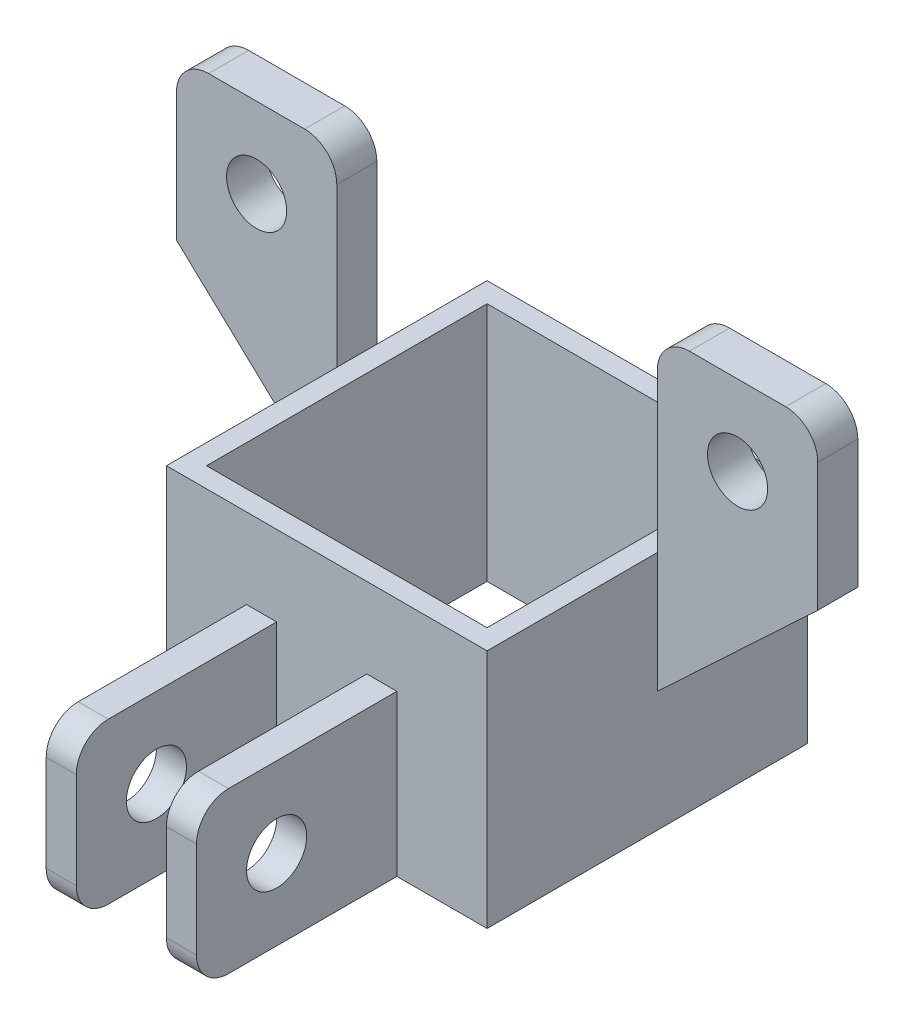
from build123d import *

# Parameters (mm, degrees)
SKETCH2_W           = 50.8
SKETCH2_H           = 38.1
BOSS_EXTRUDE1_DEPTH = 50.8
SKETCH5_W           = 44.45
SKETCH5_H           = 44.45
CUT_EXTRUDE3_DEPTH  = 82.319677815
SKETCH7_W           = 4.7625
SKETCH7_H           = 25.4
BOSS_EXTRUDE2_DEPTH = 31.75
FILLET1_R           = 5.08
SKETCH8_R           = 4.7625
CUT_EXTRUDE4_DEPTH  = 74.248977169
BOSS_EXTRUDE3_DEPTH = 6.35
SKETCH10_R          = 4.7625
CUT_EXTRUDE5_DEPTH  = 118.96738029
FILLET2_R           = 5.08


with BuildPart() as part:
    # Sketch2 → Boss-Extrude1 (new body)
    with BuildSketch(Plane.XY):
        with Locations((25.4, 19.05)):
            Rectangle(SKETCH2_W, SKETCH2_H)
    extrude(amount=-BOSS_EXTRUDE1_DEPTH)

    # Sketch5 → Cut-Extrude3 (cut, through all)
    with BuildSketch(Plane(origin=(0, 38.1, 0), x_dir=(1, 0, 0), z_dir=(0, 1, 0))):
        with Locations((25.4, 25.4)):
            Rectangle(SKETCH5_W, SKETCH5_H)
    extrude(amount=-CUT_EXTRUDE3_DEPTH, mode=Mode.SUBTRACT)

    # Sketch7 → Boss-Extrude2 (add)
    with BuildSketch(Plane.XY):
        with Locations((15.08125, 12.7)):
            Rectangle(SKETCH7_W, SKETCH7_H)
        with Locations((34.13125, 12.7)):
            Rectangle(SKETCH7_W, SKETCH7_H)
    extrude(amount=BOSS_EXTRUDE2_DEPTH)

    # Fillet1
    fillet1_edges = [part.edges().sort_by_distance(p)[0] for p in [
        (15.08125, 0, 31.75),
        (15.08125, 25.4, 31.75),
        (34.13125, 0, 31.75),
        (34.13125, 25.4, 31.75),
    ]]
    fillet(fillet1_edges, radius=FILLET1_R)

    # Sketch8 → Cut-Extrude4 (cut, through all)
    with BuildSketch(Plane(origin=(36.5125, 0, 0), x_dir=(0, 0, -1), z_dir=(1, 0, 0))):
        with Locations((-19.05, 12.7)):
            Circle(SKETCH8_R)
    extrude(amount=-CUT_EXTRUDE4_DEPTH, mode=Mode.SUBTRACT)

    # Sketch9 → Boss-Extrude3 (add)
    with BuildSketch(Plane(origin=(0, 0, -33.3375), x_dir=(-1, 0, 0), z_dir=(0, 0, -1))):
        Polygon((0, 38.1), (0, 68.2625), (25.4, 68.2625), (25.4, 42.8625), (0, 19.05), align=None)
        Polygon((-76.2, 42.8625), (-50.8, 19.05), (-50.8, 38.1), (-50.8, 68.2625), (-76.2, 68.2625), align=None)
    extrude(amount=-BOSS_EXTRUDE3_DEPTH)

    # Sketch10 → Cut-Extrude5 (cut, through all)
    with BuildSketch(Plane.XY.offset(-26.9875)):
        with Locations((-12.7, 55.5625)):
            Circle(SKETCH10_R)
        with Locations((63.5, 55.5625)):
            Circle(SKETCH10_R)
    extrude(amount=-CUT_EXTRUDE5_DEPTH, mode=Mode.SUBTRACT)

    # Fillet2
    fillet2_edges = [part.edges().sort_by_distance(p)[0] for p in [
        (76.2, 68.2625, -30.1625),
        (50.8, 68.2625, -30.1625),
        (0, 68.2625, -30.1625),
        (-25.4, 68.2625, -30.1625),
    ]]
    fillet(fillet2_edges, radius=FILLET2_R)


solid = part.part
